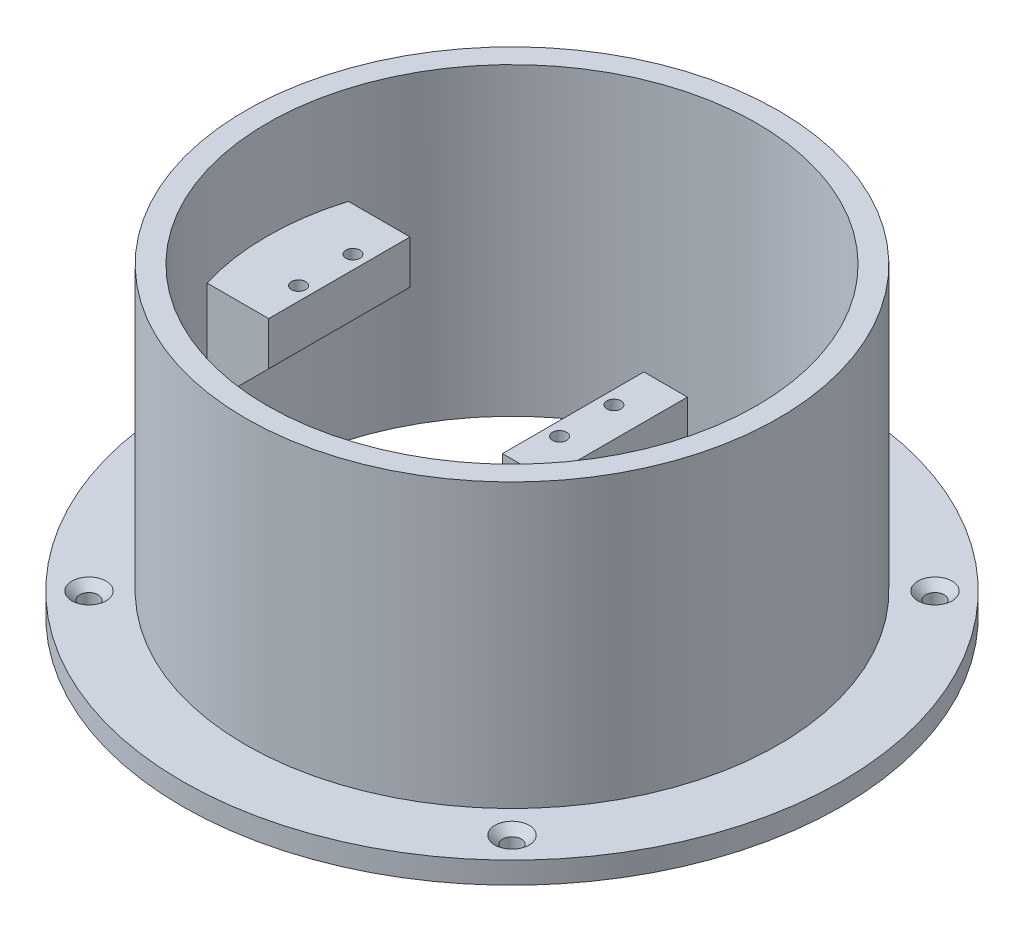
from build123d import *

# Parameters (mm, degrees)
SKETCH1_R                                           = 60.625
SKETCH1_R_2                                         = 45
BOSS_EXTRUDE1_DEPTH                                 = 4
SKETCH2_R                                           = 49
SKETCH2_R_2                                         = 45
BOSS_EXTRUDE2_DEPTH                                 = 52
SKETCH4_W                                           = 13.25
SKETCH4_H                                           = 8
SKETCH4_W_2                                         = 8
SKETCH4_H_2                                         = 38
BOSS_EXTRUDE4_DEPTH                                 = 13
BOSS_EXTRUDE5_DEPTH                                 = 4
SKETCH7_R                                           = 1.3
CUT_EXTRUDE4_DEPTH                                  = 7.2
SKETCH9_W                                           = 10
SKETCH9_H                                           = 24
CUT_EXTRUDE7_DEPTH                                  = 8
CUT_EXTRUDE9_DEPTH                                  = 101.273532151
CSK_FOR_M3_COUNTERSUNK_FLAT_HEAD_SCREW1_D           = 3.4
CSK_FOR_M3_COUNTERSUNK_FLAT_HEAD_SCREW1_CSINK_D     = 6.3
CSK_FOR_M3_COUNTERSUNK_FLAT_HEAD_SCREW1_CSINK_ANGLE = 90


with BuildPart() as part:
    # Sketch1 → Boss-Extrude1 (new body)
    with BuildSketch(Plane(origin=(0, 0, 0), x_dir=(1, 0, 0), z_dir=(0, 1, 0))):
        with Locations(Location((0, 0, 0), (0, 0, 270))):
            Circle(SKETCH1_R)
        with Locations(Location((0, 0, 0), (0, 0, 270))):
            Circle(SKETCH1_R_2, mode=Mode.SUBTRACT)
    extrude(amount=BOSS_EXTRUDE1_DEPTH)

    # Sketch2 → Boss-Extrude2 (add)
    with BuildSketch(Plane(origin=(0, 4, 0), x_dir=(1, 0, 0), z_dir=(0, 1, 0))):
        with Locations(Location((0, 0, 0), (0, 0, 90))):
            Circle(SKETCH2_R)
        with Locations(Location((0, 0, 0), (0, 0, 270))):
            Circle(SKETCH2_R_2, mode=Mode.SUBTRACT)
    extrude(amount=BOSS_EXTRUDE2_DEPTH)

    # Sketch4 → Boss-Extrude4 (add, symmetric)
    with BuildSketch(Plane.XY):
        with Locations((-38.375, 34)):
            Rectangle(SKETCH4_W, SKETCH4_H)
        Polygon((-31.75, 30), (-45, 30), (-45, 16.75), align=None)
        with Locations((15.25, 19)):
            Rectangle(SKETCH4_W_2, SKETCH4_H_2)
    extrude(amount=BOSS_EXTRUDE4_DEPTH, both=True)


with BuildPart() as boss_extrude4_piece_1:
    # of the separate pieces the step leaves, piece 1, a body of its own (boss_extrude4_pieces)
    add(part.part.solids().sort_by_distance((0, 0, 60.625))[0])



with BuildPart() as boss_extrude4_piece_2:
    # of the separate pieces the step leaves, piece 2, a body of its own (boss_extrude4_pieces)
    add(part.part.solids().sort_by_distance((11.25, 38, -13))[0])


with BuildPart() as boss_extrude4_piece_1_1:
    add(boss_extrude4_piece_1.part)

    add(boss_extrude4_piece_2.part)  # Boss-Extrude5 merges Boss-Extrude4 piece 2
    # Sketch5 → Boss-Extrude5 (add)
    with BuildSketch(Plane.XZ):
        with BuildLine():
            Line((11.25, 13), (29.067400866, 34.352382842))
            ThreePointArc((29.067400866, 34.352382842), (45, 0), (29.067400866, -34.352382842))
            Line((29.067400866, -34.352382842), (11.25, -13))
            Line((11.25, -13), (11.25, 13))
        make_face()
    extrude(amount=-BOSS_EXTRUDE5_DEPTH)

    # Sketch7 → Cut-Extrude4 (cut)
    with BuildSketch(Plane(origin=(0, 38, 0), x_dir=(1, 0, 0), z_dir=(0, 1, 0))):
        with Locations(Location((-34.25, 5, 0), (0, 0, 180))):
            Circle(SKETCH7_R)
        with Locations(Location((-34.25, -5, 0), (0, 0, 180))):
            Circle(SKETCH7_R)
        with Locations(Location((13.75, 5, 0), (0, 0, 180))):
            Circle(SKETCH7_R)
        with Locations(Location((13.75, -5, 0), (0, 0, 180))):
            Circle(SKETCH7_R)
    extrude(amount=-CUT_EXTRUDE4_DEPTH, mode=Mode.SUBTRACT)

    # Sketch9 → Cut-Extrude7 (cut)
    with BuildSketch(Plane.ZY.offset(-11.25)):
        with Locations((0, 17)):
            Rectangle(SKETCH9_W, SKETCH9_H)
    extrude(amount=-CUT_EXTRUDE7_DEPTH, mode=Mode.SUBTRACT)

    # Sketch12 → Cut-Extrude9 (cut, through all)
    with BuildSketch(Plane(origin=(0, 4, 0), x_dir=(1, 0, 0), z_dir=(0, 1, 0))):
        with BuildLine():
            Line((29.479537487, 22.359715328), (27.25, 19.687836398))
            Line((27.25, 19.687836398), (27.25, -19.687836398))
            Line((27.25, -19.687836398), (29.479537487, -22.359715328))
            ThreePointArc((29.479537487, -22.359715328), (37, 0), (29.479537487, 22.359715328))
        make_face()
        Polygon((27.25, -19.687836398), (27.25, 19.687836398), (24.25, 16.092634774), (24.25, -16.092634774), align=None)
    extrude(amount=-CUT_EXTRUDE9_DEPTH, mode=Mode.SUBTRACT)

    # CSK for M3 Countersunk Flat Head Screw1 (through all)
    with Locations(Plane(origin=(0, 4, 0), x_dir=(1, 0, 0), z_dir=(0, 1, 0))):
        with Locations((-38.890872965, 38.890872965), (-38.890872965, -38.890872965), (38.890872965, -38.890872965), (38.890872965, 38.890872965)):
            CounterSinkHole(CSK_FOR_M3_COUNTERSUNK_FLAT_HEAD_SCREW1_D / 2, CSK_FOR_M3_COUNTERSUNK_FLAT_HEAD_SCREW1_CSINK_D / 2, counter_sink_angle=CSK_FOR_M3_COUNTERSUNK_FLAT_HEAD_SCREW1_CSINK_ANGLE)


solid = boss_extrude4_piece_1_1.part
